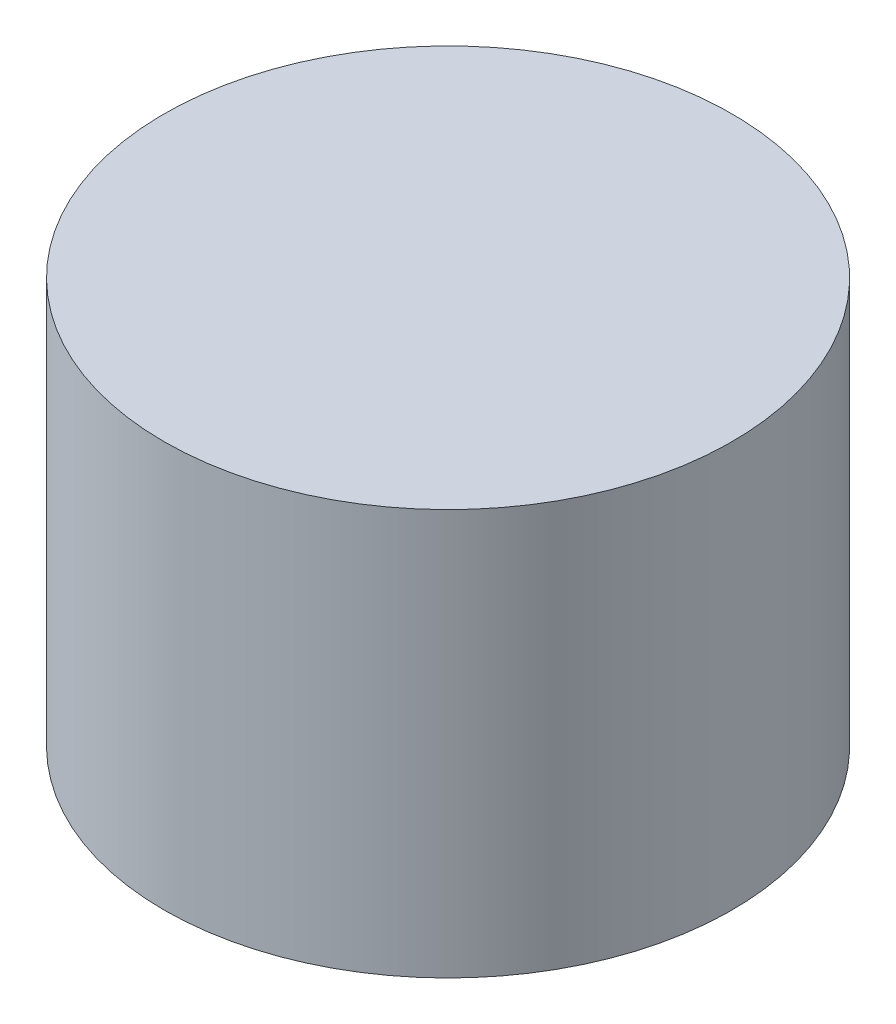
from build123d import *

# Parameters (mm, degrees)
SKETCH1_R           = 3.5
BOSS_EXTRUDE1_DEPTH = 5


with BuildPart() as part:
    # Sketch1 → Boss-Extrude1 (new body)
    with BuildSketch(Plane(origin=(0, 0, 0), x_dir=(1, 0, 0), z_dir=(0, 1, 0))):
        with Locations(Location((0, 0, 0), (0, 0, 270))):
            Circle(SKETCH1_R)
    extrude(amount=BOSS_EXTRUDE1_DEPTH)


solid = part.part
